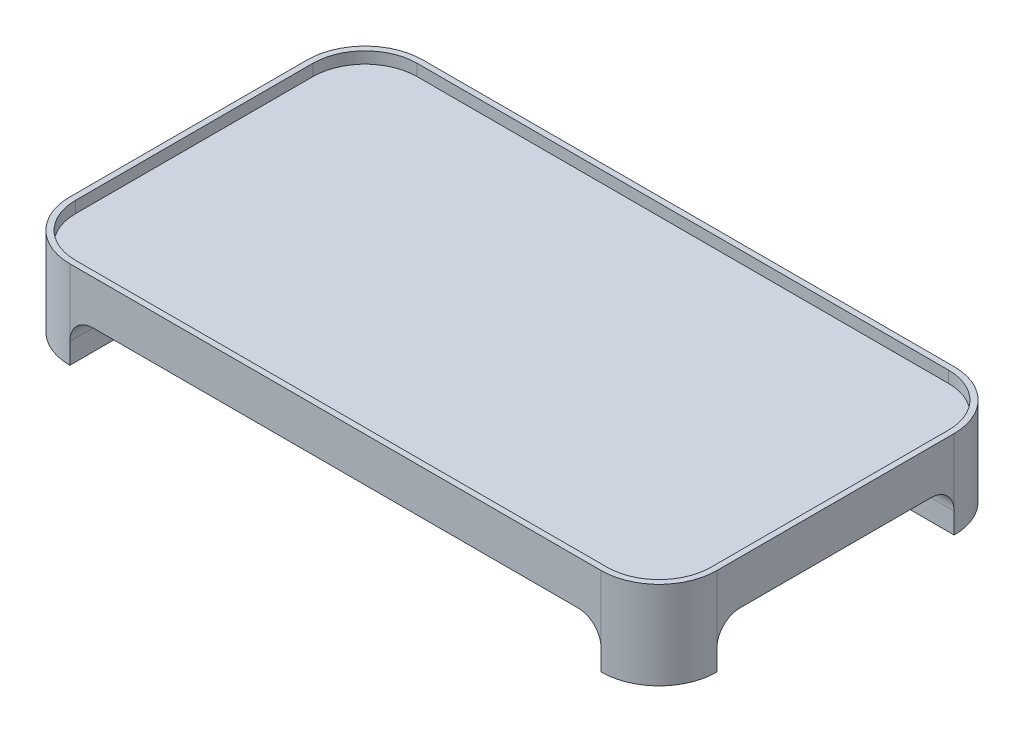
from build123d import *

# Parameters (mm, degrees)
BOSS_EXTRUDE1_DEPTH = 76
CUT_EXTRUDE1_DEPTH  = 10
CUT_EXTRUDE2_DEPTH  = 421.62007798
CUT_EXTRUDE3_DEPTH  = 585.391350039


with BuildPart() as part:
    # Sketch1 → Boss-Extrude1 (new body)
    with BuildSketch(Plane(origin=(0, 0, 0), x_dir=(1, 0, 0), z_dir=(0, 1, 0))):
        with BuildLine():
            Line((-229.5, 152.5), (229.5, 152.5))
            ThreePointArc((229.5, 152.5), (264.855339059, 137.855339059), (279.5, 102.5))
            Line((279.5, 102.5), (279.5, -102.5))
            ThreePointArc((279.5, -102.5), (264.855339059, -137.855339059), (229.5, -152.5))
            Line((229.5, -152.5), (-229.5, -152.5))
            ThreePointArc((-229.5, -152.5), (-264.855339059, -137.855339059), (-279.5, -102.5))
            Line((-279.5, -102.5), (-279.5, 102.5))
            ThreePointArc((-279.5, 102.5), (-264.855339059, 137.855339059), (-229.5, 152.5))
        make_face()
    extrude(amount=BOSS_EXTRUDE1_DEPTH)

    # Sketch3 → Cut-Extrude1 (cut)
    with BuildSketch(Plane(origin=(0, 76, 0), x_dir=(1, 0, 0), z_dir=(0, 1, 0))):
        with BuildLine():
            Line((-274.5, 102.5), (-274.5, -102.5))
            ThreePointArc((-274.5, -102.5), (-261.319805153, -134.319805153), (-229.5, -147.5))
            Line((-229.5, -147.5), (229.5, -147.5))
            ThreePointArc((229.5, -147.5), (261.319805153, -134.319805153), (274.5, -102.5))
            Line((274.5, -102.5), (274.5, 102.5))
            ThreePointArc((274.5, 102.5), (261.319805153, 134.319805153), (229.5, 147.5))
            Line((229.5, 147.5), (-229.5, 147.5))
            ThreePointArc((-229.5, 147.5), (-261.319805153, 134.319805153), (-274.5, 102.5))
        make_face()
    extrude(amount=-CUT_EXTRUDE1_DEPTH, mode=Mode.SUBTRACT)

    # Sketch4 → Cut-Extrude2 (cut, through all)
    with BuildSketch(Plane.XY.offset(152.5)):
        with BuildLine():
            Line((-229.5, 0), (-229.5, 18))
            ThreePointArc((-229.5, 18), (-223.642135624, 32.142135624), (-209.5, 38))
            Line((-209.5, 38), (209.5, 38))
            ThreePointArc((209.5, 38), (223.642135624, 32.142135624), (229.5, 18))
            Line((229.5, 18), (229.5, 0))
            Line((229.5, 0), (-229.5, 0))
        make_face()
    extrude(amount=-CUT_EXTRUDE2_DEPTH, mode=Mode.SUBTRACT)

    # Sketch5 → Cut-Extrude3 (cut, through all)
    with BuildSketch(Plane.ZY.offset(279.5)):
        with BuildLine():
            Line((-102.5, 0), (-102.5, 18))
            ThreePointArc((-102.5, 18), (-96.642135624, 32.142135624), (-82.5, 38))
            Line((-82.5, 38), (82.5, 38))
            ThreePointArc((82.5, 38), (96.642135624, 32.142135624), (102.5, 18))
            Line((102.5, 18), (102.5, 0))
            Line((102.5, 0), (-102.5, 0))
        make_face()
    extrude(amount=-CUT_EXTRUDE3_DEPTH, mode=Mode.SUBTRACT)


solid = part.part
